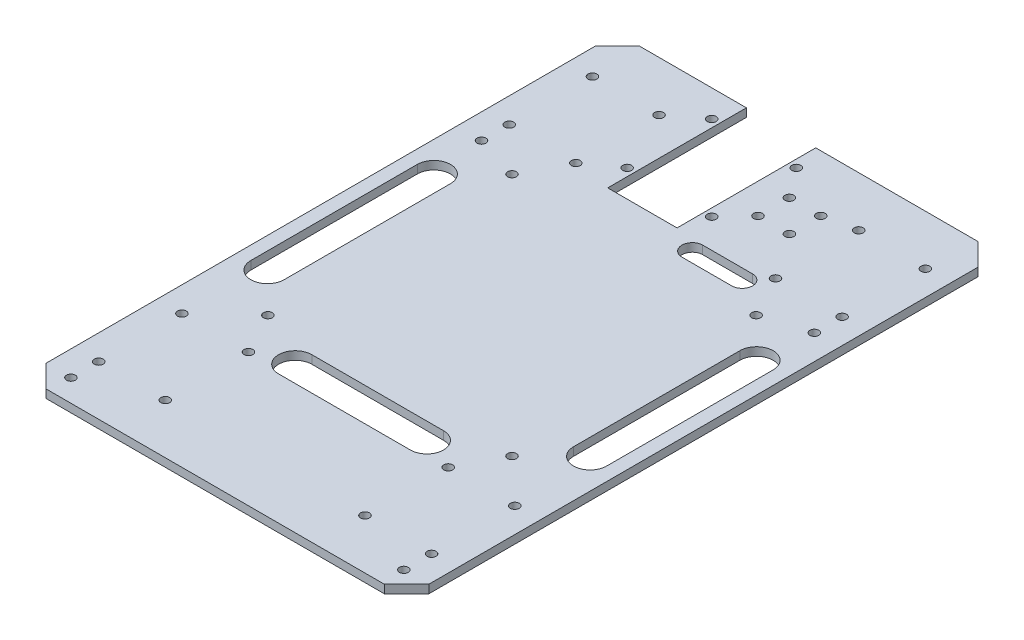
from build123d import *

# Parameters (mm, degrees)
SKETCH_1_R      = 1.6
EXTRUDE_2_DEPTH = 3


with BuildPart() as part:
    # 草图1 → 凸台-拉伸2 (new body)
    with BuildSketch(Plane(origin=(0, 0, 0), x_dir=(1, 0, 0), z_dir=(0, 1, 0))):
        Polygon((-61, 107), (-22.5, 107), (-22.5, 57), (2.5, 57), (2.5, 107), (61, 107), (69, 99), (69, -99), (61, -107), (-61, -107), (-69, -99), (-69, 99), align=None)
        with Locations(Location((60, 59, 0), (0, 0, 270))):
            Circle(SKETCH_1_R, mode=Mode.SUBTRACT)
        with Locations(Location((36, 59, 0), (0, 0, 270))):
            Circle(SKETCH_1_R, mode=Mode.SUBTRACT)
        with Locations(Location((60, 89, 0), (0, 0, 270))):
            Circle(SKETCH_1_R, mode=Mode.SUBTRACT)
        with Locations(Location((36, 89, 0), (0, 0, 270))):
            Circle(SKETCH_1_R, mode=Mode.SUBTRACT)
        with Locations(Location((-60, 89, 0), (0, 0, 270))):
            Circle(SKETCH_1_R, mode=Mode.SUBTRACT)
        with Locations(Location((-60, 59, 0), (0, 0, 270))):
            Circle(SKETCH_1_R, mode=Mode.SUBTRACT)
        with Locations(Location((-36, 89, 0), (0, 0, 270))):
            Circle(SKETCH_1_R, mode=Mode.SUBTRACT)
        with Locations(Location((-36, 59, 0), (0, 0, 270))):
            Circle(SKETCH_1_R, mode=Mode.SUBTRACT)
        with Locations(Location((60, -59, 0), (0, 0, 90))):
            Circle(SKETCH_1_R, mode=Mode.SUBTRACT)
        with Locations(Location((60, -89, 0), (0, 0, 90))):
            Circle(SKETCH_1_R, mode=Mode.SUBTRACT)
        with Locations(Location((36, -59, 0), (0, 0, 90))):
            Circle(SKETCH_1_R, mode=Mode.SUBTRACT)
        with Locations(Location((36, -89, 0), (0, 0, 90))):
            Circle(SKETCH_1_R, mode=Mode.SUBTRACT)
        with Locations(Location((-36, -59, 0), (0, 0, 90))):
            Circle(SKETCH_1_R, mode=Mode.SUBTRACT)
        with Locations(Location((-36, -89, 0), (0, 0, 90))):
            Circle(SKETCH_1_R, mode=Mode.SUBTRACT)
        with Locations(Location((-60, -59, 0), (0, 0, 90))):
            Circle(SKETCH_1_R, mode=Mode.SUBTRACT)
        with Locations(Location((-60, -89, 0), (0, 0, 90))):
            Circle(SKETCH_1_R, mode=Mode.SUBTRACT)
        with Locations(Location((44, 44, 0), (0, 0, 270))):
            Circle(SKETCH_1_R, mode=Mode.SUBTRACT)
        with Locations(Location((60, 49, 0), (0, 0, 270))):
            Circle(SKETCH_1_R, mode=Mode.SUBTRACT)
        with Locations(Location((60, -99, 0), (0, 0, 270))):
            Circle(SKETCH_1_R, mode=Mode.SUBTRACT)
        with Locations(Location((-44, 44, 0), (0, 0, 90))):
            Circle(SKETCH_1_R, mode=Mode.SUBTRACT)
        with Locations(Location((44, -44, 0), (0, 0, 90))):
            Circle(SKETCH_1_R, mode=Mode.SUBTRACT)
        with Locations(Location((-44, -44, 0), (0, 0, 270))):
            Circle(SKETCH_1_R, mode=Mode.SUBTRACT)
        with Locations(Location((-60, -99, 0), (0, 0, 90))):
            Circle(SKETCH_1_R, mode=Mode.SUBTRACT)
        with Locations(Location((-60, 49, 0), (0, 0, 90))):
            Circle(SKETCH_1_R, mode=Mode.SUBTRACT)
        with Locations(Location((24.656854249, 75.343145751, 0), (0, 0, 270))):
            Circle(SKETCH_1_R, mode=Mode.SUBTRACT)
        with Locations(Location((-25.25, 97.25, 0), (0, 0, 270))):
            Circle(SKETCH_1_R, mode=Mode.SUBTRACT)
        with Locations(Location((5.25, 97.25, 0), (0, 0, 90))):
            Circle(SKETCH_1_R, mode=Mode.SUBTRACT)
        with Locations(Location((-25.25, 66.75, 0), (0, 0, 270))):
            Circle(SKETCH_1_R, mode=Mode.SUBTRACT)
        with Locations(Location((5.25, 66.75, 0), (0, 0, 90))):
            Circle(SKETCH_1_R, mode=Mode.SUBTRACT)
        with Locations(Location((13.343145751, 75.343145751, 0), (0, 0, 270))):
            Circle(SKETCH_1_R, mode=Mode.SUBTRACT)
        with Locations(Location((13.343145751, 86.656854249, 0), (0, 0, 270))):
            Circle(SKETCH_1_R, mode=Mode.SUBTRACT)
        with Locations(Location((24.656854249, 86.656854249, 0), (0, 0, 270))):
            Circle(SKETCH_1_R, mode=Mode.SUBTRACT)
        with BuildLine():
            Line((-52.158528232, 30), (-52.158528232, -30))
            ThreePointArc((-52.158528232, -30), (-58.158528232, -36), (-64.158528232, -30))
            Line((-64.158528232, -30), (-64.158528232, 30))
            ThreePointArc((-64.158528232, 30), (-58.158528232, 36), (-52.158528232, 30))
        make_face(mode=Mode.SUBTRACT)
        with BuildLine():
            Line((52.158528232, 30), (52.158528232, -30))
            ThreePointArc((52.158528232, -30), (58.158528232, -36), (64.158528232, -30))
            Line((64.158528232, -30), (64.158528232, 30))
            ThreePointArc((64.158528232, 30), (58.158528232, 36), (52.158528232, 30))
        make_face(mode=Mode.SUBTRACT)
        with BuildLine():
            Line((-23.75, -48.403395609), (23.75, -48.403395609))
            ThreePointArc((23.75, -48.403395609), (29.75, -54.403395609), (23.75, -60.403395609))
            Line((23.75, -60.403395609), (-23.75, -60.403395609))
            ThreePointArc((-23.75, -60.403395609), (-29.75, -54.403395609), (-23.75, -48.403395609))
        make_face(mode=Mode.SUBTRACT)
        with BuildLine():
            Line((12.5, 56.262836439), (30.458741979, 56.262836439))
            ThreePointArc((30.458741979, 56.262836439), (34.208741979, 52.512836439), (30.458741979, 48.762836439))
            Line((30.458741979, 48.762836439), (12.5, 48.762836439))
            ThreePointArc((12.5, 48.762836439), (8.75, 52.512836439), (12.5, 56.262836439))
        make_face(mode=Mode.SUBTRACT)
    extrude(amount=EXTRUDE_2_DEPTH)


solid = part.part
